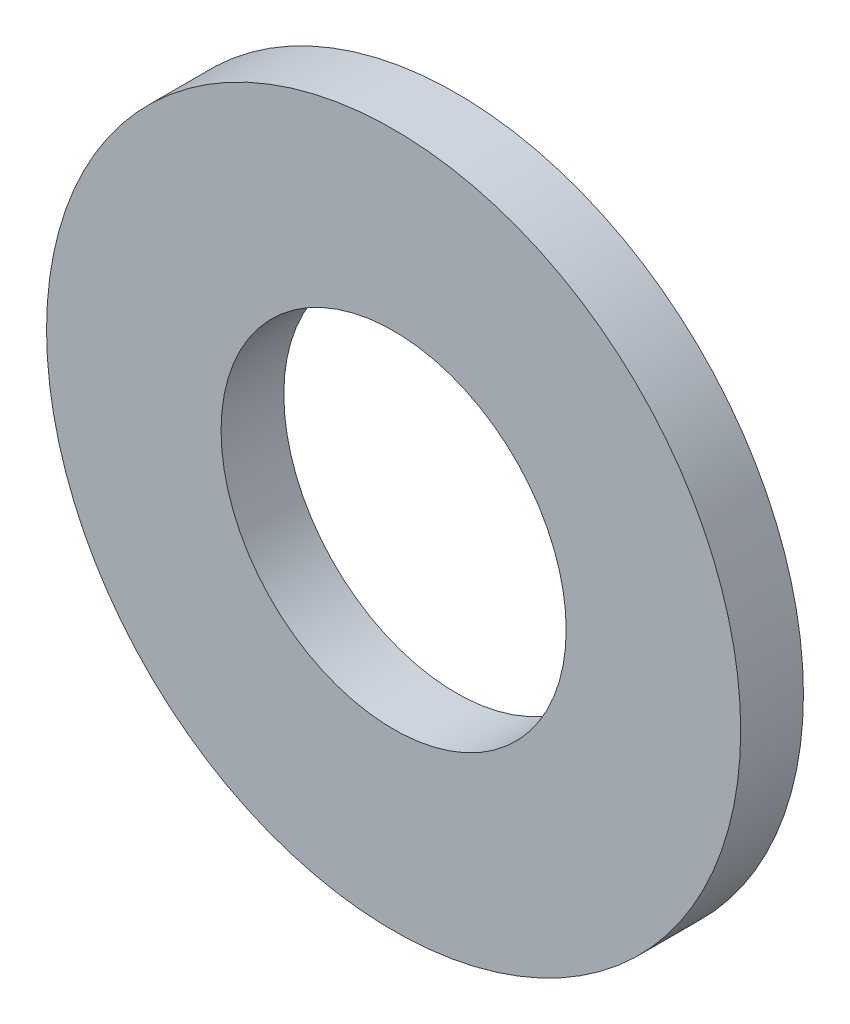
from build123d import *

# Parameters (mm, degrees)
SKETCH1_R           = 4.425
SKETCH1_R_2         = 2.2
BOSS_EXTRUDE1_DEPTH = 0.8


with BuildPart() as part:
    # Sketch1 → Boss-Extrude1 (new body)
    with BuildSketch(Plane.XY):
        Circle(SKETCH1_R)
        Circle(SKETCH1_R_2, mode=Mode.SUBTRACT)
    extrude(amount=BOSS_EXTRUDE1_DEPTH)


solid = part.part
